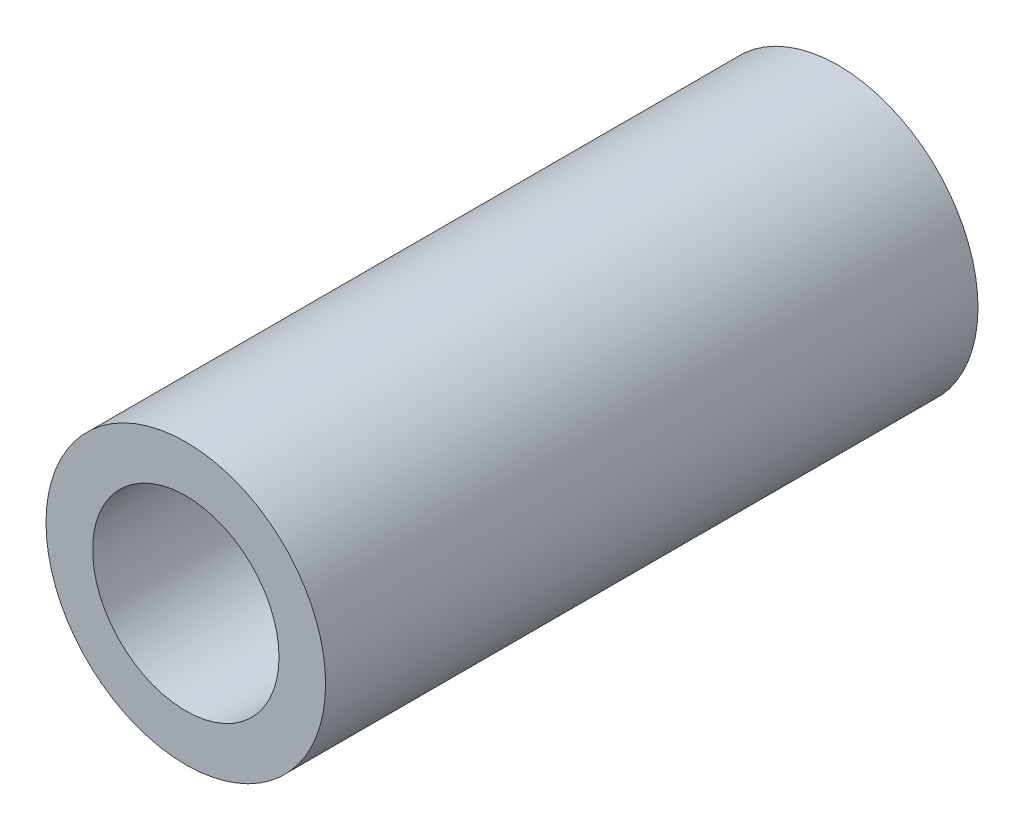
from build123d import *

# Parameters (mm, degrees)
ESQUISSE1_R        = 3
ESQUISSE1_R_2      = 2
EXTRU_MINCE1_DEPTH = 14


with BuildPart() as part:
    # Esquisse1 → Extru.-Mince1 (new body)
    with BuildSketch(Plane.XY):
        Circle(ESQUISSE1_R)
        Circle(ESQUISSE1_R_2, mode=Mode.SUBTRACT)
    extrude(amount=EXTRU_MINCE1_DEPTH)


solid = part.part
